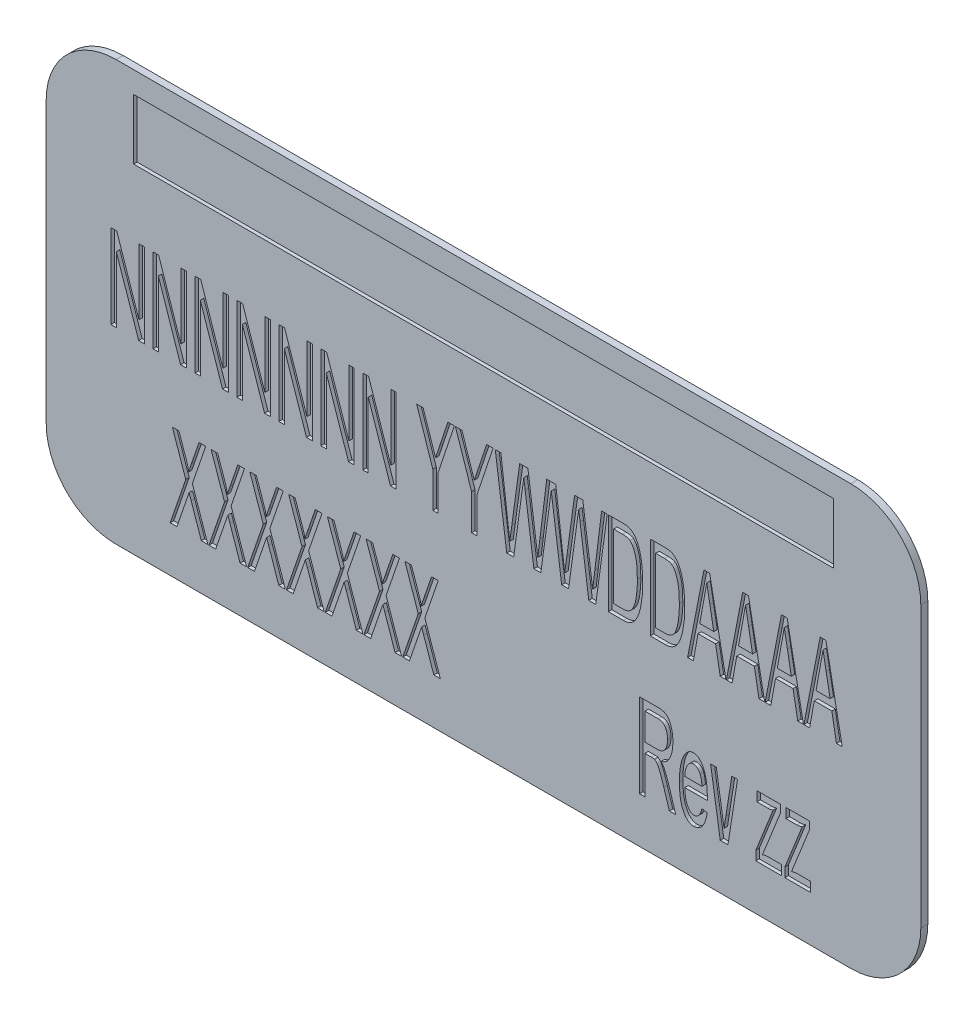
from build123d import *

# Parameters (mm, degrees)
BOSS_EXTRU_1_DEPTH      = 0.2
ENL_V_MAT_EXTRU_1_DEPTH = 0.1
ENL_V_MAT_EXTRU_2_DEPTH = 0.1
ESQUISSE10_W            = 20
ESQUISSE10_H            = 1.725075407
ENL_V_MAT_EXTRU_3_DEPTH = 0.1


with BuildPart() as part:
    # Esquisse1 → Boss.-Extru.1 (new body)
    with BuildSketch(Plane.XY):
        with BuildLine():
            Line((-21.848822837, 2.338176796), (-0.848822837, 2.338176796))
            ThreePointArc((-0.848822837, 2.338176796), (0.565390725, 1.752390358), (1.151177163, 0.338176796))
            Line((1.151177163, 0.338176796), (1.151177163, -7.661823204))
            ThreePointArc((1.151177163, -7.661823204), (0.565390725, -9.076036767), (-0.848822837, -9.661823204))
            Line((-0.848822837, -9.661823204), (-21.848822837, -9.661823204))
            ThreePointArc((-21.848822837, -9.661823204), (-23.263036399, -9.076036767), (-23.848822837, -7.661823204))
            Line((-23.848822837, -7.661823204), (-23.848822837, 0.338176796))
            ThreePointArc((-23.848822837, 0.338176796), (-23.263036399, 1.752390358), (-21.848822837, 2.338176796))
        make_face()
    extrude(amount=BOSS_EXTRU_1_DEPTH)

    # Esquisse2 → Enlèv. mat.-Extru.1 (cut)
    # profile 1 of 17: a face of its own
    with BuildSketch(Plane.XY.offset(0.2)):
        Polygon((-21.997375607, -4.2960697), (-21.997375607, -1.8960697), (-21.83295253, -1.8960697), (-21.197375607, -3.7773197), (-21.197375607, -1.8960697), (-21.043529453, -1.8960697), (-21.043529453, -4.2960697), (-21.20795253, -4.2960697), (-21.843529453, -2.415781238), (-21.843529453, -4.2960697), align=None)
    # profile 2 of 17: a face of its own
    with BuildSketch(Plane.XY.offset(0.2)):
        Polygon((-20.797375607, -4.2960697), (-20.797375607, -1.8960697), (-20.63295253, -1.8960697), (-19.997375607, -3.7773197), (-19.997375607, -1.8960697), (-19.843529453, -1.8960697), (-19.843529453, -4.2960697), (-20.00795253, -4.2960697), (-20.643529453, -2.415781238), (-20.643529453, -4.2960697), align=None)
    # profile 3 of 17: a face of its own
    with BuildSketch(Plane.XY.offset(0.2)):
        Polygon((-19.597375607, -4.2960697), (-19.597375607, -1.8960697), (-19.43295253, -1.8960697), (-18.797375607, -3.7773197), (-18.797375607, -1.8960697), (-18.643529453, -1.8960697), (-18.643529453, -4.2960697), (-18.80795253, -4.2960697), (-19.443529453, -2.415781238), (-19.443529453, -4.2960697), align=None)
    # profile 4 of 17: a face of its own
    with BuildSketch(Plane.XY.offset(0.2)):
        Polygon((-18.397375607, -4.2960697), (-18.397375607, -1.8960697), (-18.23295253, -1.8960697), (-17.597375607, -3.7773197), (-17.597375607, -1.8960697), (-17.443529453, -1.8960697), (-17.443529453, -4.2960697), (-17.60795253, -4.2960697), (-18.243529453, -2.415781238), (-18.243529453, -4.2960697), align=None)
    # profile 5 of 17: a face of its own
    with BuildSketch(Plane.XY.offset(0.2)):
        Polygon((-17.197375607, -4.2960697), (-17.197375607, -1.8960697), (-17.03295253, -1.8960697), (-16.397375607, -3.7773197), (-16.397375607, -1.8960697), (-16.243529453, -1.8960697), (-16.243529453, -4.2960697), (-16.40795253, -4.2960697), (-17.043529453, -2.415781238), (-17.043529453, -4.2960697), align=None)
    # profile 6 of 17: a face of its own
    with BuildSketch(Plane.XY.offset(0.2)):
        Polygon((-15.997375607, -4.2960697), (-15.997375607, -1.8960697), (-15.83295253, -1.8960697), (-15.197375607, -3.7773197), (-15.197375607, -1.8960697), (-15.043529453, -1.8960697), (-15.043529453, -4.2960697), (-15.20795253, -4.2960697), (-15.843529453, -2.415781238), (-15.843529453, -4.2960697), align=None)
    # profile 7 of 17: a face of its own
    with BuildSketch(Plane.XY.offset(0.2)):
        Polygon((-14.797375607, -4.2960697), (-14.797375607, -1.8960697), (-14.63295253, -1.8960697), (-13.997375607, -3.7773197), (-13.997375607, -1.8960697), (-13.843529453, -1.8960697), (-13.843529453, -4.2960697), (-14.00795253, -4.2960697), (-14.643529453, -2.415781238), (-14.643529453, -4.2960697), align=None)
    # profile 8 of 17: a face of its own
    with BuildSketch(Plane.XY.offset(0.2)):
        with BuildLine():
            Line((-12.797375607, -4.2960697), (-12.797375607, -3.279242777))
            Line((-12.797375607, -3.279242777), (-13.258914068, -1.8960697))
            Line((-13.258914068, -1.8960697), (-13.073817915, -1.8960697))
            Line((-13.073817915, -1.8960697), (-12.827664068, -2.634531238))
            add(Edge.make_bspline(
                [(-12.827664068, -2.634531238), (-12.817067101, -2.666255268), (-12.796997087, -2.726338659), (-12.768867352, -2.811567966), (-12.743009071, -2.886493789), (-12.727613049, -2.933392326), (-12.72045253, -2.955204315)],
                knots=[0, 0, 0, 0, 1.187045161, 2.248191592, 3.185253382, 4, 4, 4, 4], degree=3))
            add(Edge.make_bspline(
                [(-12.72045253, -2.955204315), (-12.717103326, -2.945102744), (-12.709974274, -2.923600726), (-12.698301361, -2.889564566), (-12.685939781, -2.85148447), (-12.672066077, -2.809793962), (-12.656454381, -2.764571995), (-12.640292101, -2.715417778), (-12.622425768, -2.662773253), (-12.610335281, -2.626365232), (-12.604106376, -2.607608161)],
                knots=[0, 0, 0, 0, 0.696802911, 1.483201767, 2.355870768, 3.318122407, 4.360029798, 5.488186892, 6.705937452, 8, 8, 8, 8], degree=3))
            Line((-12.604106376, -2.607608161), (-12.367087145, -1.8960697))
            Line((-12.367087145, -1.8960697), (-12.181990991, -1.8960697))
            Line((-12.181990991, -1.8960697), (-12.643529453, -3.279242777))
            Line((-12.643529453, -3.279242777), (-12.643529453, -4.2960697))
            Line((-12.643529453, -4.2960697), (-12.797375607, -4.2960697))
        make_face()
    # profile 9 of 17: a face of its own
    with BuildSketch(Plane.XY.offset(0.2)):
        with BuildLine():
            Line((-11.689683299, -4.2960697), (-11.689683299, -3.279242777))
            Line((-11.689683299, -3.279242777), (-12.151221761, -1.8960697))
            Line((-12.151221761, -1.8960697), (-11.966125607, -1.8960697))
            Line((-11.966125607, -1.8960697), (-11.719971761, -2.634531238))
            add(Edge.make_bspline(
                [(-11.719971761, -2.634531238), (-11.709374793, -2.666255268), (-11.68930478, -2.726338659), (-11.661175045, -2.811567966), (-11.635316764, -2.886493789), (-11.619920741, -2.933392326), (-11.612760222, -2.955204315)],
                knots=[0, 0, 0, 0, 1.187045161, 2.248191592, 3.185253382, 4, 4, 4, 4], degree=3))
            add(Edge.make_bspline(
                [(-11.612760222, -2.955204315), (-11.609411019, -2.945102744), (-11.602281966, -2.923600726), (-11.590609053, -2.889564566), (-11.578247473, -2.85148447), (-11.564373769, -2.809793962), (-11.548762073, -2.764571995), (-11.532599794, -2.715417778), (-11.51473346, -2.662773253), (-11.502642974, -2.626365232), (-11.496414068, -2.607608161)],
                knots=[0, 0, 0, 0, 0.696802911, 1.483201767, 2.355870768, 3.318122407, 4.360029798, 5.488186892, 6.705937452, 8, 8, 8, 8], degree=3))
            Line((-11.496414068, -2.607608161), (-11.259394838, -1.8960697))
            Line((-11.259394838, -1.8960697), (-11.074298684, -1.8960697))
            Line((-11.074298684, -1.8960697), (-11.535837145, -3.279242777))
            Line((-11.535837145, -3.279242777), (-11.535837145, -4.2960697))
            Line((-11.535837145, -4.2960697), (-11.689683299, -4.2960697))
        make_face()
    # profile 10 of 17: a face of its own
    with BuildSketch(Plane.XY.offset(0.2)):
        with BuildLine():
            Line((-10.684394838, -4.2960697), (-11.012760222, -1.8960697))
            Line((-11.012760222, -1.8960697), (-10.853144838, -1.8960697))
            Line((-10.853144838, -1.8960697), (-10.657471761, -3.473954315))
            add(Edge.make_bspline(
                [(-10.657471761, -3.473954315), (-10.64734577, -3.55520063), (-10.62713556, -3.717358111), (-10.607281913, -3.879559634), (-10.597375607, -3.960492777)],
                knots=[0, 0, 0, 0, 1.002066804, 2, 2, 2, 2], degree=3))
            add(Edge.make_bspline(
                [(-10.597375607, -3.960492777), (-10.59334946, -3.931008296), (-10.585757099, -3.875407539), (-10.575331413, -3.796839168), (-10.565567178, -3.728131758), (-10.557443171, -3.66915054), (-10.550742272, -3.620108005), (-10.545306797, -3.58102531), (-10.541670379, -3.551647588), (-10.53922511, -3.535329395), (-10.538240991, -3.528762007)],
                knots=[0, 0, 0, 0, 1.638949351, 3.090670897, 4.365107455, 5.461054644, 6.369771406, 7.091258957, 7.634269859, 8, 8, 8, 8], degree=3))
            Line((-10.538240991, -3.528762007), (-10.314683299, -1.8960697))
            Line((-10.314683299, -1.8960697), (-10.080067915, -1.8960697))
            Line((-10.080067915, -1.8960697), (-9.913721761, -3.110492777))
            add(Edge.make_bspline(
                [(-9.913721761, -3.110492777), (-9.903395012, -3.184201056), (-9.883014943, -3.329665999), (-9.854065415, -3.545146419), (-9.824841618, -3.754666571), (-9.806444072, -3.892535049), (-9.797375607, -3.960492777)],
                knots=[0, 0, 0, 0, 1.041039999, 2.054515778, 3.041037602, 4, 4, 4, 4], degree=3))
            add(Edge.make_bspline(
                [(-9.797375607, -3.960492777), (-9.792900857, -3.923792532), (-9.783539984, -3.847018114), (-9.768606492, -3.72666907), (-9.752165978, -3.596091717), (-9.741096244, -3.50552847), (-9.735356376, -3.4585697)],
                knots=[0, 0, 0, 0, 0.87725687, 1.835161778, 2.8774901, 4, 4, 4, 4], degree=3))
            Line((-9.735356376, -3.4585697), (-9.541606376, -1.8960697))
            Line((-9.541606376, -1.8960697), (-9.381990991, -1.8960697))
            Line((-9.381990991, -1.8960697), (-9.710356376, -4.2960697))
            Line((-9.710356376, -4.2960697), (-9.908433299, -4.2960697))
            Line((-9.908433299, -4.2960697), (-10.15795253, -2.474915854))
            add(Edge.make_bspline(
                [(-10.15795253, -2.474915854), (-10.160342745, -2.456805094), (-10.16489179, -2.422336787), (-10.171579216, -2.37329137), (-10.177935955, -2.329579239), (-10.183303599, -2.29096665), (-10.187492477, -2.257434043), (-10.191267169, -2.229057283), (-10.194833616, -2.205870674), (-10.196597195, -2.192066473), (-10.197375607, -2.185973546)],
                knots=[0, 0, 0, 0, 1.503406976, 2.861276566, 4.073641829, 5.138672782, 6.06948784, 6.854747432, 7.494505974, 8, 8, 8, 8], degree=3))
            add(Edge.make_bspline(
                [(-10.197375607, -2.185973546), (-10.201544917, -2.216101371), (-10.209439293, -2.273146869), (-10.220595945, -2.354063071), (-10.230051455, -2.42574122), (-10.236293275, -2.47043203), (-10.23920253, -2.491262007)],
                knots=[0, 0, 0, 0, 1.184456801, 2.242708451, 3.180942521, 4, 4, 4, 4], degree=3))
            Line((-10.23920253, -2.491262007), (-10.486798684, -4.2960697))
            Line((-10.486798684, -4.2960697), (-10.684394838, -4.2960697))
        make_face()
    # profile 11 of 17: a face of its own
    with BuildSketch(Plane.XY.offset(0.2)):
        with BuildLine():
            Line((-9.115164068, -4.2960697), (-9.443529453, -1.8960697))
            Line((-9.443529453, -1.8960697), (-9.283914068, -1.8960697))
            Line((-9.283914068, -1.8960697), (-9.088240991, -3.473954315))
            add(Edge.make_bspline(
                [(-9.088240991, -3.473954315), (-9.078115001, -3.55520063), (-9.057904791, -3.717358111), (-9.038051144, -3.879559634), (-9.028144838, -3.960492777)],
                knots=[0, 0, 0, 0, 1.002066804, 2, 2, 2, 2], degree=3))
            add(Edge.make_bspline(
                [(-9.028144838, -3.960492777), (-9.024118691, -3.931008296), (-9.016526329, -3.875407539), (-9.006100643, -3.796839168), (-8.996336409, -3.728131758), (-8.988212402, -3.66915054), (-8.981511503, -3.620108005), (-8.976076028, -3.58102531), (-8.972439609, -3.551647588), (-8.96999434, -3.535329395), (-8.969010222, -3.528762007)],
                knots=[0, 0, 0, 0, 1.638949351, 3.090670897, 4.365107455, 5.461054644, 6.369771406, 7.091258957, 7.634269859, 8, 8, 8, 8], degree=3))
            Line((-8.969010222, -3.528762007), (-8.74545253, -1.8960697))
            Line((-8.74545253, -1.8960697), (-8.510837145, -1.8960697))
            Line((-8.510837145, -1.8960697), (-8.344490991, -3.110492777))
            add(Edge.make_bspline(
                [(-8.344490991, -3.110492777), (-8.334164243, -3.184201056), (-8.313784174, -3.329665999), (-8.284834645, -3.545146419), (-8.255610849, -3.754666571), (-8.237213302, -3.892535049), (-8.228144838, -3.960492777)],
                knots=[0, 0, 0, 0, 1.041039999, 2.054515778, 3.041037602, 4, 4, 4, 4], degree=3))
            add(Edge.make_bspline(
                [(-8.228144838, -3.960492777), (-8.223670088, -3.923792532), (-8.214309215, -3.847018114), (-8.199375722, -3.72666907), (-8.182935208, -3.596091717), (-8.171865475, -3.50552847), (-8.166125607, -3.4585697)],
                knots=[0, 0, 0, 0, 0.87725687, 1.835161778, 2.8774901, 4, 4, 4, 4], degree=3))
            Line((-8.166125607, -3.4585697), (-7.972375607, -1.8960697))
            Line((-7.972375607, -1.8960697), (-7.812760222, -1.8960697))
            Line((-7.812760222, -1.8960697), (-8.141125607, -4.2960697))
            Line((-8.141125607, -4.2960697), (-8.33920253, -4.2960697))
            Line((-8.33920253, -4.2960697), (-8.588721761, -2.474915854))
            add(Edge.make_bspline(
                [(-8.588721761, -2.474915854), (-8.591111976, -2.456805094), (-8.595661021, -2.422336787), (-8.602348446, -2.37329137), (-8.608705186, -2.329579239), (-8.61407283, -2.29096665), (-8.618261708, -2.257434043), (-8.6220364, -2.229057283), (-8.625602847, -2.205870674), (-8.627366425, -2.192066473), (-8.628144838, -2.185973546)],
                knots=[0, 0, 0, 0, 1.503406976, 2.861276566, 4.073641829, 5.138672782, 6.06948784, 6.854747432, 7.494505974, 8, 8, 8, 8], degree=3))
            add(Edge.make_bspline(
                [(-8.628144838, -2.185973546), (-8.632314148, -2.216101371), (-8.640208523, -2.273146869), (-8.651365176, -2.354063071), (-8.660820686, -2.42574122), (-8.667062506, -2.47043203), (-8.669971761, -2.491262007)],
                knots=[0, 0, 0, 0, 1.184456801, 2.242708451, 3.180942521, 4, 4, 4, 4], degree=3))
            Line((-8.669971761, -2.491262007), (-8.917567915, -4.2960697))
            Line((-8.917567915, -4.2960697), (-9.115164068, -4.2960697))
        make_face()
    # profile 12 of 17: a face of its own
    with BuildSketch(Plane.XY.offset(0.2)):
        with BuildLine():
            Line((-7.781990991, -4.2960697), (-7.781990991, -1.8960697))
            Line((-7.781990991, -1.8960697), (-7.371894838, -1.8960697))
            add(Edge.make_bspline(
                [(-7.371894838, -1.8960697), (-7.350069147, -1.896272053), (-7.30902258, -1.89665261), (-7.25185344, -1.90372178), (-7.202192317, -1.913210612), (-7.173360356, -1.925116625), (-7.159875607, -1.930685084)],
                knots=[0, 0, 0, 0, 1.209218742, 2.274121739, 3.192804279, 4, 4, 4, 4], degree=3))
            add(Edge.make_bspline(
                [(-7.159875607, -1.930685084), (-7.1429887, -1.939553597), (-7.108524287, -1.957653304), (-7.062559089, -1.99699691), (-7.020469971, -2.04542114), (-6.997032248, -2.082886978), (-6.984875607, -2.1023197)],
                knots=[0, 0, 0, 0, 0.917248745, 1.872008839, 2.896256901, 4, 4, 4, 4], degree=3))
            add(Edge.make_bspline(
                [(-6.984875607, -2.1023197), (-6.969512609, -2.130712462), (-6.937663802, -2.189573081), (-6.900374035, -2.287459236), (-6.86834118, -2.395819561), (-6.842091141, -2.515043085), (-6.822557043, -2.644234502), (-6.80745918, -2.782469394), (-6.798962305, -2.92977629), (-6.797914749, -3.030995025), (-6.797375607, -3.08308893)],
                knots=[0, 0, 0, 0, 0.767236926, 1.590547629, 2.485512821, 3.453908061, 4.491812888, 5.592276963, 6.760825303, 8, 8, 8, 8], degree=3))
            add(Edge.make_bspline(
                [(-6.797375607, -3.08308893), (-6.797734491, -3.127325518), (-6.798431779, -3.213274234), (-6.804101816, -3.338375127), (-6.814120268, -3.455772153), (-6.828056545, -3.565114852), (-6.844761439, -3.665988029), (-6.863863141, -3.758098618), (-6.885292506, -3.841073982), (-6.908774243, -3.915291549), (-6.934587797, -3.980856525), (-6.960532503, -4.039332869), (-6.988754761, -4.090049996), (-7.017325855, -4.134479041), (-7.048962859, -4.172386037), (-7.082910352, -4.20529648), (-7.120528117, -4.23276087), (-7.160522679, -4.256351706), (-7.204212878, -4.273917856), (-7.250740589, -4.287094084), (-7.300480146, -4.294858602), (-7.334688136, -4.295659892), (-7.352183299, -4.2960697)],
                knots=[0, 0, 0, 0, 1.800094546, 3.497462691, 5.094565961, 6.593423588, 7.981807382, 9.254415828, 10.420159978, 11.4678544, 12.419732639, 13.286514356, 14.068783023, 14.77961528, 15.432569631, 16.073692928, 16.698454999, 17.323727399, 17.958316615, 18.608660443, 19.28842027, 20, 20, 20, 20], degree=3))
            Line((-7.352183299, -4.2960697), (-7.781990991, -4.2960697))
        make_face()
        with BuildLine():
            Line((-7.628144838, -4.019146623), (-7.369010222, -4.019146623))
            add(Edge.make_bspline(
                [(-7.369010222, -4.019146623), (-7.350070326, -4.018612707), (-7.31423792, -4.017602591), (-7.263549605, -4.009607202), (-7.219262298, -3.995742153), (-7.180760123, -3.976354059), (-7.148017238, -3.950779936), (-7.118601781, -3.921541031), (-7.092801506, -3.887480237), (-7.078956833, -3.862286232), (-7.071894838, -3.849435084)],
                knots=[0, 0, 0, 0, 1.249650705, 2.364215218, 3.374377069, 4.301504878, 5.192076899, 6.104488424, 7.03312322, 8, 8, 8, 8], degree=3))
            add(Edge.make_bspline(
                [(-7.071894838, -3.849435084), (-7.062507897, -3.82892486), (-7.042651381, -3.785538884), (-7.01994002, -3.713252216), (-6.999179296, -3.631927373), (-6.982119415, -3.540529515), (-6.968308134, -3.439296282), (-6.95846237, -3.327796821), (-6.952077435, -3.206240683), (-6.951514351, -3.121719502), (-6.951221761, -3.077800469)],
                knots=[0, 0, 0, 0, 0.687444329, 1.454174466, 2.306617836, 3.247115966, 4.288242282, 5.422094717, 6.6604647, 8, 8, 8, 8], degree=3))
            add(Edge.make_bspline(
                [(-6.951221761, -3.077800469), (-6.951396663, -3.047189318), (-6.951736478, -2.987715521), (-6.954632478, -2.901146476), (-6.959411483, -2.820031756), (-6.965782424, -2.744446197), (-6.975329987, -2.674467518), (-6.985306014, -2.609670497), (-6.998482148, -2.550557708), (-7.012925305, -2.496654269), (-7.028826796, -2.447614193), (-7.045580352, -2.402816981), (-7.063238842, -2.362278093), (-7.082187372, -2.326169336), (-7.101128545, -2.293725891), (-7.121394006, -2.26571803), (-7.142396901, -2.241686011), (-7.158097617, -2.228736664), (-7.165644838, -2.222512007)],
                knots=[0, 0, 0, 0, 1.624486671, 3.156182828, 4.595991041, 5.936527029, 7.180250294, 8.343530302, 9.414514798, 10.39240733, 11.304157138, 12.14925215, 12.929879803, 13.64881622, 14.312455318, 14.921477323, 15.481561996, 16, 16, 16, 16], degree=3))
            add(Edge.make_bspline(
                [(-7.165644838, -2.222512007), (-7.177703233, -2.214711662), (-7.203700334, -2.197894634), (-7.252244455, -2.183930835), (-7.309445517, -2.173946744), (-7.350999189, -2.173326305), (-7.373337145, -2.172992777)],
                knots=[0, 0, 0, 0, 0.790842195, 1.705003453, 2.766281536, 4, 4, 4, 4], degree=3))
            Line((-7.373337145, -2.172992777), (-7.628144838, -2.172992777))
            Line((-7.628144838, -2.172992777), (-7.628144838, -4.019146623))
        make_face(mode=Mode.SUBTRACT)
    # profile 13 of 17: a face of its own
    with BuildSketch(Plane.XY.offset(0.2)):
        with BuildLine():
            Line((-6.581990991, -4.2960697), (-6.581990991, -1.8960697))
            Line((-6.581990991, -1.8960697), (-6.171894838, -1.8960697))
            add(Edge.make_bspline(
                [(-6.171894838, -1.8960697), (-6.150069147, -1.896272053), (-6.10902258, -1.89665261), (-6.05185344, -1.90372178), (-6.002192317, -1.913210612), (-5.973360356, -1.925116625), (-5.959875607, -1.930685084)],
                knots=[0, 0, 0, 0, 1.209218742, 2.274121739, 3.192804279, 4, 4, 4, 4], degree=3))
            add(Edge.make_bspline(
                [(-5.959875607, -1.930685084), (-5.9429887, -1.939553597), (-5.908524287, -1.957653304), (-5.862559089, -1.99699691), (-5.820469971, -2.04542114), (-5.797032248, -2.082886978), (-5.784875607, -2.1023197)],
                knots=[0, 0, 0, 0, 0.917248745, 1.872008839, 2.896256901, 4, 4, 4, 4], degree=3))
            add(Edge.make_bspline(
                [(-5.784875607, -2.1023197), (-5.769512609, -2.130712462), (-5.737663802, -2.189573081), (-5.700374035, -2.287459236), (-5.66834118, -2.395819561), (-5.642091141, -2.515043085), (-5.622557043, -2.644234502), (-5.60745918, -2.782469394), (-5.598962305, -2.92977629), (-5.597914749, -3.030995025), (-5.597375607, -3.08308893)],
                knots=[0, 0, 0, 0, 0.767236926, 1.590547629, 2.485512821, 3.453908061, 4.491812888, 5.592276963, 6.760825303, 8, 8, 8, 8], degree=3))
            add(Edge.make_bspline(
                [(-5.597375607, -3.08308893), (-5.597734491, -3.127325518), (-5.598431779, -3.213274234), (-5.604101816, -3.338375127), (-5.614120268, -3.455772153), (-5.628056545, -3.565114852), (-5.644761439, -3.665988029), (-5.663863141, -3.758098618), (-5.685292506, -3.841073982), (-5.708774243, -3.915291549), (-5.734587797, -3.980856525), (-5.760532503, -4.039332869), (-5.788754761, -4.090049996), (-5.817325855, -4.134479041), (-5.848962859, -4.172386037), (-5.882910352, -4.20529648), (-5.920528117, -4.23276087), (-5.960522679, -4.256351706), (-6.004212878, -4.273917856), (-6.050740589, -4.287094084), (-6.100480146, -4.294858602), (-6.134688136, -4.295659892), (-6.152183299, -4.2960697)],
                knots=[0, 0, 0, 0, 1.800094546, 3.497462691, 5.094565961, 6.593423588, 7.981807382, 9.254415828, 10.420159978, 11.4678544, 12.419732639, 13.286514356, 14.068783023, 14.77961528, 15.432569631, 16.073692928, 16.698454999, 17.323727399, 17.958316615, 18.608660443, 19.28842027, 20, 20, 20, 20], degree=3))
            Line((-6.152183299, -4.2960697), (-6.581990991, -4.2960697))
        make_face()
        with BuildLine():
            Line((-6.428144838, -4.019146623), (-6.169010222, -4.019146623))
            add(Edge.make_bspline(
                [(-6.169010222, -4.019146623), (-6.150070326, -4.018612707), (-6.11423792, -4.017602591), (-6.063549605, -4.009607202), (-6.019262298, -3.995742153), (-5.980760123, -3.976354059), (-5.948017238, -3.950779936), (-5.918601781, -3.921541031), (-5.892801506, -3.887480237), (-5.878956833, -3.862286232), (-5.871894838, -3.849435084)],
                knots=[0, 0, 0, 0, 1.249650705, 2.364215218, 3.374377069, 4.301504878, 5.192076899, 6.104488424, 7.03312322, 8, 8, 8, 8], degree=3))
            add(Edge.make_bspline(
                [(-5.871894838, -3.849435084), (-5.862507897, -3.82892486), (-5.842651381, -3.785538884), (-5.81994002, -3.713252216), (-5.799179296, -3.631927373), (-5.782119415, -3.540529515), (-5.768308134, -3.439296282), (-5.75846237, -3.327796821), (-5.752077435, -3.206240683), (-5.751514351, -3.121719502), (-5.751221761, -3.077800469)],
                knots=[0, 0, 0, 0, 0.687444329, 1.454174466, 2.306617836, 3.247115966, 4.288242282, 5.422094717, 6.6604647, 8, 8, 8, 8], degree=3))
            add(Edge.make_bspline(
                [(-5.751221761, -3.077800469), (-5.751396663, -3.047189318), (-5.751736478, -2.987715521), (-5.754632478, -2.901146476), (-5.759411483, -2.820031756), (-5.765782424, -2.744446197), (-5.775329987, -2.674467518), (-5.785306014, -2.609670497), (-5.798482148, -2.550557708), (-5.812925305, -2.496654269), (-5.828826796, -2.447614193), (-5.845580352, -2.402816981), (-5.863238842, -2.362278093), (-5.882187372, -2.326169336), (-5.901128545, -2.293725891), (-5.921394006, -2.26571803), (-5.942396901, -2.241686011), (-5.958097617, -2.228736664), (-5.965644838, -2.222512007)],
                knots=[0, 0, 0, 0, 1.624486671, 3.156182828, 4.595991041, 5.936527029, 7.180250294, 8.343530302, 9.414514798, 10.39240733, 11.304157138, 12.14925215, 12.929879803, 13.64881622, 14.312455318, 14.921477323, 15.481561996, 16, 16, 16, 16], degree=3))
            add(Edge.make_bspline(
                [(-5.965644838, -2.222512007), (-5.977703233, -2.214711662), (-6.003700334, -2.197894634), (-6.052244455, -2.183930835), (-6.109445517, -2.173946744), (-6.150999189, -2.173326305), (-6.173337145, -2.172992777)],
                knots=[0, 0, 0, 0, 0.790842195, 1.705003453, 2.766281536, 4, 4, 4, 4], degree=3))
            Line((-6.173337145, -2.172992777), (-6.428144838, -2.172992777))
            Line((-6.428144838, -2.172992777), (-6.428144838, -4.019146623))
        make_face(mode=Mode.SUBTRACT)
    # profile 14 of 17: a face of its own
    with BuildSketch(Plane.XY.offset(0.2)):
        Polygon((-5.514683299, -4.2960697), (-5.048337145, -1.8960697), (-4.884875607, -1.8960697), (-4.418529453, -4.2960697), (-4.581990991, -4.2960697), (-4.715644838, -3.557608161), (-5.217087145, -3.557608161), (-5.351221761, -4.2960697), align=None)
        with BuildLine():
            Line((-5.167087145, -3.280685084), (-4.766125607, -3.280685084))
            Line((-4.766125607, -3.280685084), (-4.878625607, -2.659531238))
            add(Edge.make_bspline(
                [(-4.878625607, -2.659531238), (-4.883146751, -2.63501815), (-4.891949862, -2.587288759), (-4.904237011, -2.517509795), (-4.916598193, -2.451414092), (-4.927291481, -2.388820304), (-4.938108839, -2.329728617), (-4.948017641, -2.274245704), (-4.957796779, -2.222381837), (-4.963747036, -2.189023033), (-4.966606376, -2.172992777)],
                knots=[0, 0, 0, 0, 1.209945762, 2.355883214, 3.439198162, 4.473827899, 5.438166865, 6.355192696, 7.209603446, 8, 8, 8, 8], degree=3))
            add(Edge.make_bspline(
                [(-4.966606376, -2.172992777), (-4.979872677, -2.246877314), (-5.006582583, -2.395633853), (-5.03371789, -2.544313382), (-5.047375607, -2.619146623)],
                knots=[0, 0, 0, 0, 0.993361883, 2, 2, 2, 2], degree=3))
            Line((-5.047375607, -2.619146623), (-5.167087145, -3.280685084))
        make_face(mode=Mode.SUBTRACT)
    # profile 15 of 17: a face of its own
    with BuildSketch(Plane.XY.offset(0.2)):
        Polygon((-4.406990991, -4.2960697), (-3.940644838, -1.8960697), (-3.777183299, -1.8960697), (-3.310837145, -4.2960697), (-3.474298684, -4.2960697), (-3.60795253, -3.557608161), (-4.109394838, -3.557608161), (-4.243529453, -4.2960697), align=None)
        with BuildLine():
            Line((-4.059394838, -3.280685084), (-3.658433299, -3.280685084))
            Line((-3.658433299, -3.280685084), (-3.770933299, -2.659531238))
            add(Edge.make_bspline(
                [(-3.770933299, -2.659531238), (-3.775454443, -2.63501815), (-3.784257555, -2.587288759), (-3.796544703, -2.517509795), (-3.808905885, -2.451414092), (-3.819599173, -2.388820304), (-3.830416532, -2.329728617), (-3.840325334, -2.274245704), (-3.850104472, -2.222381837), (-3.856054729, -2.189023033), (-3.858914068, -2.172992777)],
                knots=[0, 0, 0, 0, 1.209945762, 2.355883214, 3.439198162, 4.473827899, 5.438166865, 6.355192696, 7.209603446, 8, 8, 8, 8], degree=3))
            add(Edge.make_bspline(
                [(-3.858914068, -2.172992777), (-3.872180369, -2.246877314), (-3.898890275, -2.395633853), (-3.926025582, -2.544313382), (-3.939683299, -2.619146623)],
                knots=[0, 0, 0, 0, 0.993361883, 2, 2, 2, 2], degree=3))
            Line((-3.939683299, -2.619146623), (-4.059394838, -3.280685084))
        make_face(mode=Mode.SUBTRACT)
    # profile 16 of 17: a face of its own
    with BuildSketch(Plane.XY.offset(0.2)):
        Polygon((-3.299298684, -4.2960697), (-2.83295253, -1.8960697), (-2.669490991, -1.8960697), (-2.203144838, -4.2960697), (-2.366606376, -4.2960697), (-2.500260222, -3.557608161), (-3.00170253, -3.557608161), (-3.135837145, -4.2960697), align=None)
        with BuildLine():
            Line((-2.95170253, -3.280685084), (-2.550740991, -3.280685084))
            Line((-2.550740991, -3.280685084), (-2.663240991, -2.659531238))
            add(Edge.make_bspline(
                [(-2.663240991, -2.659531238), (-2.667762136, -2.63501815), (-2.676565247, -2.587288759), (-2.688852395, -2.517509795), (-2.701213578, -2.451414092), (-2.711906865, -2.388820304), (-2.722724224, -2.329728617), (-2.732633026, -2.274245704), (-2.742412164, -2.222381837), (-2.748362421, -2.189023033), (-2.751221761, -2.172992777)],
                knots=[0, 0, 0, 0, 1.209945762, 2.355883214, 3.439198162, 4.473827899, 5.438166865, 6.355192696, 7.209603446, 8, 8, 8, 8], degree=3))
            add(Edge.make_bspline(
                [(-2.751221761, -2.172992777), (-2.764488062, -2.246877314), (-2.791197967, -2.395633853), (-2.818333274, -2.544313382), (-2.831990991, -2.619146623)],
                knots=[0, 0, 0, 0, 0.993361883, 2, 2, 2, 2], degree=3))
            Line((-2.831990991, -2.619146623), (-2.95170253, -3.280685084))
        make_face(mode=Mode.SUBTRACT)
    # profile 17 of 17: a face of its own
    with BuildSketch(Plane.XY.offset(0.2)):
        Polygon((-2.191606376, -4.2960697), (-1.725260222, -1.8960697), (-1.561798684, -1.8960697), (-1.09545253, -4.2960697), (-1.258914068, -4.2960697), (-1.392567915, -3.557608161), (-1.894010222, -3.557608161), (-2.028144838, -4.2960697), align=None)
        with BuildLine():
            Line((-1.844010222, -3.280685084), (-1.443048684, -3.280685084))
            Line((-1.443048684, -3.280685084), (-1.555548684, -2.659531238))
            add(Edge.make_bspline(
                [(-1.555548684, -2.659531238), (-1.560069828, -2.63501815), (-1.568872939, -2.587288759), (-1.581160088, -2.517509795), (-1.59352127, -2.451414092), (-1.604214558, -2.388820304), (-1.615031916, -2.329728617), (-1.624940718, -2.274245704), (-1.634719856, -2.222381837), (-1.640670113, -2.189023033), (-1.643529453, -2.172992777)],
                knots=[0, 0, 0, 0, 1.209945762, 2.355883214, 3.439198162, 4.473827899, 5.438166865, 6.355192696, 7.209603446, 8, 8, 8, 8], degree=3))
            add(Edge.make_bspline(
                [(-1.643529453, -2.172992777), (-1.656795754, -2.246877314), (-1.68350566, -2.395633853), (-1.710640967, -2.544313382), (-1.724298684, -2.619146623)],
                knots=[0, 0, 0, 0, 0.993361883, 2, 2, 2, 2], degree=3))
            Line((-1.724298684, -2.619146623), (-1.844010222, -3.280685084))
        make_face(mode=Mode.SUBTRACT)
    extrude(amount=-ENL_V_MAT_EXTRU_1_DEPTH, mode=Mode.SUBTRACT)

    # Esquisse8 → Enlèv. mat.-Extru.2 (cut)
    # profile 1 of 12: a face of its own
    with BuildSketch(Plane.XY.offset(0.2)):
        with BuildLine():
            Line((-20.304250109, -8.356300295), (-19.860500109, -7.063511833))
            Line((-19.860500109, -7.063511833), (-20.242711648, -5.956300295))
            Line((-20.242711648, -5.956300295), (-20.055211648, -5.956300295))
            Line((-20.055211648, -5.956300295), (-19.837423186, -6.587069525))
            add(Edge.make_bspline(
                [(-19.837423186, -6.587069525), (-19.832433738, -6.60228607), (-19.82289605, -6.63137359), (-19.809613489, -6.673030679), (-19.799598971, -6.711108998), (-19.791746444, -6.745241203), (-19.786462029, -6.775409745), (-19.78316076, -6.801720566), (-19.783068459, -6.824319305), (-19.784739943, -6.838040751), (-19.785500109, -6.844281064)],
                knots=[0, 0, 0, 0, 1.453428248, 2.778332613, 3.967248284, 5.025801759, 5.955965637, 6.746200148, 7.429790105, 8, 8, 8, 8], degree=3))
            add(Edge.make_bspline(
                [(-19.785500109, -6.844281064), (-19.778879034, -6.825388158), (-19.765151268, -6.786216672), (-19.744858883, -6.725078534), (-19.721863247, -6.660046763), (-19.706455789, -6.615127472), (-19.698480879, -6.591877218)],
                knots=[0, 0, 0, 0, 0.899792049, 1.865578155, 2.895221838, 4, 4, 4, 4], degree=3))
            Line((-19.698480879, -6.591877218), (-19.480692417, -5.956300295))
            Line((-19.480692417, -5.956300295), (-19.288865494, -5.956300295))
            Line((-19.288865494, -5.956300295), (-19.671077033, -7.070242602))
            Line((-19.671077033, -7.070242602), (-19.227327033, -8.356300295))
            Line((-19.227327033, -8.356300295), (-19.414827033, -8.356300295))
            Line((-19.414827033, -8.356300295), (-19.706173186, -7.509665679))
            add(Edge.make_bspline(
                [(-19.706173186, -7.509665679), (-19.715326934, -7.483390245), (-19.734851235, -7.42734659), (-19.75411441, -7.371212633), (-19.764346263, -7.341396449)],
                knots=[0, 0, 0, 0, 0.937677431, 2, 2, 2, 2], degree=3))
            add(Edge.make_bspline(
                [(-19.764346263, -7.341396449), (-19.771285038, -7.361572474), (-19.783942824, -7.398377791), (-19.800533609, -7.448728435), (-19.81462384, -7.488310979), (-19.822536082, -7.511422721), (-19.825884725, -7.521204141)],
                knots=[0, 0, 0, 0, 1.347179553, 2.45753912, 3.347195111, 4, 4, 4, 4], degree=3))
            Line((-19.825884725, -7.521204141), (-20.112423186, -8.356300295))
            Line((-20.112423186, -8.356300295), (-20.304250109, -8.356300295))
        make_face()
    # profile 2 of 12: a face of its own
    with BuildSketch(Plane.XY.offset(0.2)):
        with BuildLine():
            Line((-19.196557802, -8.356300295), (-18.752807802, -7.063511833))
            Line((-18.752807802, -7.063511833), (-19.13501934, -5.956300295))
            Line((-19.13501934, -5.956300295), (-18.94751934, -5.956300295))
            Line((-18.94751934, -5.956300295), (-18.729730879, -6.587069525))
            add(Edge.make_bspline(
                [(-18.729730879, -6.587069525), (-18.724741431, -6.60228607), (-18.715203742, -6.63137359), (-18.701921182, -6.673030679), (-18.691906664, -6.711108998), (-18.684054137, -6.745241203), (-18.678769721, -6.775409745), (-18.675468452, -6.801720566), (-18.675376151, -6.824319305), (-18.677047635, -6.838040751), (-18.677807802, -6.844281064)],
                knots=[0, 0, 0, 0, 1.453428248, 2.778332613, 3.967248284, 5.025801759, 5.955965637, 6.746200148, 7.429790105, 8, 8, 8, 8], degree=3))
            add(Edge.make_bspline(
                [(-18.677807802, -6.844281064), (-18.671186726, -6.825388158), (-18.65745896, -6.786216672), (-18.637166575, -6.725078534), (-18.614170939, -6.660046763), (-18.598763481, -6.615127472), (-18.590788571, -6.591877218)],
                knots=[0, 0, 0, 0, 0.899792049, 1.865578155, 2.895221838, 4, 4, 4, 4], degree=3))
            Line((-18.590788571, -6.591877218), (-18.373000109, -5.956300295))
            Line((-18.373000109, -5.956300295), (-18.181173186, -5.956300295))
            Line((-18.181173186, -5.956300295), (-18.563384725, -7.070242602))
            Line((-18.563384725, -7.070242602), (-18.119634725, -8.356300295))
            Line((-18.119634725, -8.356300295), (-18.307134725, -8.356300295))
            Line((-18.307134725, -8.356300295), (-18.598480879, -7.509665679))
            add(Edge.make_bspline(
                [(-18.598480879, -7.509665679), (-18.607634627, -7.483390245), (-18.627158927, -7.42734659), (-18.646422103, -7.371212633), (-18.656653956, -7.341396449)],
                knots=[0, 0, 0, 0, 0.937677431, 2, 2, 2, 2], degree=3))
            add(Edge.make_bspline(
                [(-18.656653956, -7.341396449), (-18.66359273, -7.361572474), (-18.676250516, -7.398377791), (-18.692841302, -7.448728435), (-18.706931533, -7.488310979), (-18.714843775, -7.511422721), (-18.718192417, -7.521204141)],
                knots=[0, 0, 0, 0, 1.347179553, 2.45753912, 3.347195111, 4, 4, 4, 4], degree=3))
            Line((-18.718192417, -7.521204141), (-19.004730879, -8.356300295))
            Line((-19.004730879, -8.356300295), (-19.196557802, -8.356300295))
        make_face()
    # profile 3 of 12: a face of its own
    with BuildSketch(Plane.XY.offset(0.2)):
        with BuildLine():
            Line((-18.088865494, -8.356300295), (-17.645115494, -7.063511833))
            Line((-17.645115494, -7.063511833), (-18.027327033, -5.956300295))
            Line((-18.027327033, -5.956300295), (-17.839827033, -5.956300295))
            Line((-17.839827033, -5.956300295), (-17.622038571, -6.587069525))
            add(Edge.make_bspline(
                [(-17.622038571, -6.587069525), (-17.617049123, -6.60228607), (-17.607511434, -6.63137359), (-17.594228874, -6.673030679), (-17.584214356, -6.711108998), (-17.576361829, -6.745241203), (-17.571077413, -6.775409745), (-17.567776144, -6.801720566), (-17.567683844, -6.824319305), (-17.569355327, -6.838040751), (-17.570115494, -6.844281064)],
                knots=[0, 0, 0, 0, 1.453428248, 2.778332613, 3.967248284, 5.025801759, 5.955965637, 6.746200148, 7.429790105, 8, 8, 8, 8], degree=3))
            add(Edge.make_bspline(
                [(-17.570115494, -6.844281064), (-17.563494418, -6.825388158), (-17.549766653, -6.786216672), (-17.529474268, -6.725078534), (-17.506478632, -6.660046763), (-17.491071174, -6.615127472), (-17.483096263, -6.591877218)],
                knots=[0, 0, 0, 0, 0.899792049, 1.865578155, 2.895221838, 4, 4, 4, 4], degree=3))
            Line((-17.483096263, -6.591877218), (-17.265307802, -5.956300295))
            Line((-17.265307802, -5.956300295), (-17.073480879, -5.956300295))
            Line((-17.073480879, -5.956300295), (-17.455692417, -7.070242602))
            Line((-17.455692417, -7.070242602), (-17.011942417, -8.356300295))
            Line((-17.011942417, -8.356300295), (-17.199442417, -8.356300295))
            Line((-17.199442417, -8.356300295), (-17.490788571, -7.509665679))
            add(Edge.make_bspline(
                [(-17.490788571, -7.509665679), (-17.499942319, -7.483390245), (-17.51946662, -7.42734659), (-17.538729795, -7.371212633), (-17.548961648, -7.341396449)],
                knots=[0, 0, 0, 0, 0.937677431, 2, 2, 2, 2], degree=3))
            add(Edge.make_bspline(
                [(-17.548961648, -7.341396449), (-17.555900423, -7.361572474), (-17.568558208, -7.398377791), (-17.585148994, -7.448728435), (-17.599239225, -7.488310979), (-17.607151467, -7.511422721), (-17.610500109, -7.521204141)],
                knots=[0, 0, 0, 0, 1.347179553, 2.45753912, 3.347195111, 4, 4, 4, 4], degree=3))
            Line((-17.610500109, -7.521204141), (-17.897038571, -8.356300295))
            Line((-17.897038571, -8.356300295), (-18.088865494, -8.356300295))
        make_face()
    # profile 4 of 12: a face of its own
    with BuildSketch(Plane.XY.offset(0.2)):
        with BuildLine():
            Line((-16.981173186, -8.356300295), (-16.537423186, -7.063511833))
            Line((-16.537423186, -7.063511833), (-16.919634725, -5.956300295))
            Line((-16.919634725, -5.956300295), (-16.732134725, -5.956300295))
            Line((-16.732134725, -5.956300295), (-16.514346263, -6.587069525))
            add(Edge.make_bspline(
                [(-16.514346263, -6.587069525), (-16.509356815, -6.60228607), (-16.499819127, -6.63137359), (-16.486536566, -6.673030679), (-16.476522048, -6.711108998), (-16.468669521, -6.745241203), (-16.463385106, -6.775409745), (-16.460083837, -6.801720566), (-16.459991536, -6.824319305), (-16.46166302, -6.838040751), (-16.462423186, -6.844281064)],
                knots=[0, 0, 0, 0, 1.453428248, 2.778332613, 3.967248284, 5.025801759, 5.955965637, 6.746200148, 7.429790105, 8, 8, 8, 8], degree=3))
            add(Edge.make_bspline(
                [(-16.462423186, -6.844281064), (-16.455802111, -6.825388158), (-16.442074345, -6.786216672), (-16.42178196, -6.725078534), (-16.398786324, -6.660046763), (-16.383378866, -6.615127472), (-16.375403956, -6.591877218)],
                knots=[0, 0, 0, 0, 0.899792049, 1.865578155, 2.895221838, 4, 4, 4, 4], degree=3))
            Line((-16.375403956, -6.591877218), (-16.157615494, -5.956300295))
            Line((-16.157615494, -5.956300295), (-15.965788571, -5.956300295))
            Line((-15.965788571, -5.956300295), (-16.348000109, -7.070242602))
            Line((-16.348000109, -7.070242602), (-15.904250109, -8.356300295))
            Line((-15.904250109, -8.356300295), (-16.091750109, -8.356300295))
            Line((-16.091750109, -8.356300295), (-16.383096263, -7.509665679))
            add(Edge.make_bspline(
                [(-16.383096263, -7.509665679), (-16.392250011, -7.483390245), (-16.411774312, -7.42734659), (-16.431037487, -7.371212633), (-16.44126934, -7.341396449)],
                knots=[0, 0, 0, 0, 0.937677431, 2, 2, 2, 2], degree=3))
            add(Edge.make_bspline(
                [(-16.44126934, -7.341396449), (-16.448208115, -7.361572474), (-16.460865901, -7.398377791), (-16.477456686, -7.448728435), (-16.491546917, -7.488310979), (-16.499459159, -7.511422721), (-16.502807802, -7.521204141)],
                knots=[0, 0, 0, 0, 1.347179553, 2.45753912, 3.347195111, 4, 4, 4, 4], degree=3))
            Line((-16.502807802, -7.521204141), (-16.789346263, -8.356300295))
            Line((-16.789346263, -8.356300295), (-16.981173186, -8.356300295))
        make_face()
    # profile 5 of 12: a face of its own
    with BuildSketch(Plane.XY.offset(0.2)):
        with BuildLine():
            Line((-15.873480879, -8.356300295), (-15.429730879, -7.063511833))
            Line((-15.429730879, -7.063511833), (-15.811942417, -5.956300295))
            Line((-15.811942417, -5.956300295), (-15.624442417, -5.956300295))
            Line((-15.624442417, -5.956300295), (-15.406653956, -6.587069525))
            add(Edge.make_bspline(
                [(-15.406653956, -6.587069525), (-15.401664508, -6.60228607), (-15.392126819, -6.63137359), (-15.378844259, -6.673030679), (-15.368829741, -6.711108998), (-15.360977213, -6.745241203), (-15.355692798, -6.775409745), (-15.352391529, -6.801720566), (-15.352299228, -6.824319305), (-15.353970712, -6.838040751), (-15.354730879, -6.844281064)],
                knots=[0, 0, 0, 0, 1.453428248, 2.778332613, 3.967248284, 5.025801759, 5.955965637, 6.746200148, 7.429790105, 8, 8, 8, 8], degree=3))
            add(Edge.make_bspline(
                [(-15.354730879, -6.844281064), (-15.348109803, -6.825388158), (-15.334382037, -6.786216672), (-15.314089652, -6.725078534), (-15.291094016, -6.660046763), (-15.275686558, -6.615127472), (-15.267711648, -6.591877218)],
                knots=[0, 0, 0, 0, 0.899792049, 1.865578155, 2.895221838, 4, 4, 4, 4], degree=3))
            Line((-15.267711648, -6.591877218), (-15.049923186, -5.956300295))
            Line((-15.049923186, -5.956300295), (-14.858096263, -5.956300295))
            Line((-14.858096263, -5.956300295), (-15.240307802, -7.070242602))
            Line((-15.240307802, -7.070242602), (-14.796557802, -8.356300295))
            Line((-14.796557802, -8.356300295), (-14.984057802, -8.356300295))
            Line((-14.984057802, -8.356300295), (-15.275403956, -7.509665679))
            add(Edge.make_bspline(
                [(-15.275403956, -7.509665679), (-15.284557704, -7.483390245), (-15.304082004, -7.42734659), (-15.32334518, -7.371212633), (-15.333577033, -7.341396449)],
                knots=[0, 0, 0, 0, 0.937677431, 2, 2, 2, 2], degree=3))
            add(Edge.make_bspline(
                [(-15.333577033, -7.341396449), (-15.340515807, -7.361572474), (-15.353173593, -7.398377791), (-15.369764379, -7.448728435), (-15.38385461, -7.488310979), (-15.391766851, -7.511422721), (-15.395115494, -7.521204141)],
                knots=[0, 0, 0, 0, 1.347179553, 2.45753912, 3.347195111, 4, 4, 4, 4], degree=3))
            Line((-15.395115494, -7.521204141), (-15.681653956, -8.356300295))
            Line((-15.681653956, -8.356300295), (-15.873480879, -8.356300295))
        make_face()
    # profile 6 of 12: a face of its own
    with BuildSketch(Plane.XY.offset(0.2)):
        with BuildLine():
            Line((-14.765788571, -8.356300295), (-14.322038571, -7.063511833))
            Line((-14.322038571, -7.063511833), (-14.704250109, -5.956300295))
            Line((-14.704250109, -5.956300295), (-14.516750109, -5.956300295))
            Line((-14.516750109, -5.956300295), (-14.298961648, -6.587069525))
            add(Edge.make_bspline(
                [(-14.298961648, -6.587069525), (-14.2939722, -6.60228607), (-14.284434511, -6.63137359), (-14.271151951, -6.673030679), (-14.261137433, -6.711108998), (-14.253284906, -6.745241203), (-14.24800049, -6.775409745), (-14.244699221, -6.801720566), (-14.24460692, -6.824319305), (-14.246278404, -6.838040751), (-14.247038571, -6.844281064)],
                knots=[0, 0, 0, 0, 1.453428248, 2.778332613, 3.967248284, 5.025801759, 5.955965637, 6.746200148, 7.429790105, 8, 8, 8, 8], degree=3))
            add(Edge.make_bspline(
                [(-14.247038571, -6.844281064), (-14.240417495, -6.825388158), (-14.22668973, -6.786216672), (-14.206397345, -6.725078534), (-14.183401709, -6.660046763), (-14.167994251, -6.615127472), (-14.16001934, -6.591877218)],
                knots=[0, 0, 0, 0, 0.899792049, 1.865578155, 2.895221838, 4, 4, 4, 4], degree=3))
            Line((-14.16001934, -6.591877218), (-13.942230879, -5.956300295))
            Line((-13.942230879, -5.956300295), (-13.750403956, -5.956300295))
            Line((-13.750403956, -5.956300295), (-14.132615494, -7.070242602))
            Line((-14.132615494, -7.070242602), (-13.688865494, -8.356300295))
            Line((-13.688865494, -8.356300295), (-13.876365494, -8.356300295))
            Line((-13.876365494, -8.356300295), (-14.167711648, -7.509665679))
            add(Edge.make_bspline(
                [(-14.167711648, -7.509665679), (-14.176865396, -7.483390245), (-14.196389696, -7.42734659), (-14.215652872, -7.371212633), (-14.225884725, -7.341396449)],
                knots=[0, 0, 0, 0, 0.937677431, 2, 2, 2, 2], degree=3))
            add(Edge.make_bspline(
                [(-14.225884725, -7.341396449), (-14.2328235, -7.361572474), (-14.245481285, -7.398377791), (-14.262072071, -7.448728435), (-14.276162302, -7.488310979), (-14.284074544, -7.511422721), (-14.287423186, -7.521204141)],
                knots=[0, 0, 0, 0, 1.347179553, 2.45753912, 3.347195111, 4, 4, 4, 4], degree=3))
            Line((-14.287423186, -7.521204141), (-14.573961648, -8.356300295))
            Line((-14.573961648, -8.356300295), (-14.765788571, -8.356300295))
        make_face()
    # profile 7 of 12: a face of its own
    with BuildSketch(Plane.XY.offset(0.2)):
        with BuildLine():
            Line((-13.658096263, -8.356300295), (-13.214346263, -7.063511833))
            Line((-13.214346263, -7.063511833), (-13.596557802, -5.956300295))
            Line((-13.596557802, -5.956300295), (-13.409057802, -5.956300295))
            Line((-13.409057802, -5.956300295), (-13.19126934, -6.587069525))
            add(Edge.make_bspline(
                [(-13.19126934, -6.587069525), (-13.186279892, -6.60228607), (-13.176742204, -6.63137359), (-13.163459643, -6.673030679), (-13.153445125, -6.711108998), (-13.145592598, -6.745241203), (-13.140308183, -6.775409745), (-13.137006914, -6.801720566), (-13.136914613, -6.824319305), (-13.138586097, -6.838040751), (-13.139346263, -6.844281064)],
                knots=[0, 0, 0, 0, 1.453428248, 2.778332613, 3.967248284, 5.025801759, 5.955965637, 6.746200148, 7.429790105, 8, 8, 8, 8], degree=3))
            add(Edge.make_bspline(
                [(-13.139346263, -6.844281064), (-13.132725187, -6.825388158), (-13.118997422, -6.786216672), (-13.098705037, -6.725078534), (-13.075709401, -6.660046763), (-13.060301943, -6.615127472), (-13.052327033, -6.591877218)],
                knots=[0, 0, 0, 0, 0.899792049, 1.865578155, 2.895221838, 4, 4, 4, 4], degree=3))
            Line((-13.052327033, -6.591877218), (-12.834538571, -5.956300295))
            Line((-12.834538571, -5.956300295), (-12.642711648, -5.956300295))
            Line((-12.642711648, -5.956300295), (-13.024923186, -7.070242602))
            Line((-13.024923186, -7.070242602), (-12.581173186, -8.356300295))
            Line((-12.581173186, -8.356300295), (-12.768673186, -8.356300295))
            Line((-12.768673186, -8.356300295), (-13.06001934, -7.509665679))
            add(Edge.make_bspline(
                [(-13.06001934, -7.509665679), (-13.069173088, -7.483390245), (-13.088697389, -7.42734659), (-13.107960564, -7.371212633), (-13.118192417, -7.341396449)],
                knots=[0, 0, 0, 0, 0.937677431, 2, 2, 2, 2], degree=3))
            add(Edge.make_bspline(
                [(-13.118192417, -7.341396449), (-13.125131192, -7.361572474), (-13.137788978, -7.398377791), (-13.154379763, -7.448728435), (-13.168469994, -7.488310979), (-13.176382236, -7.511422721), (-13.179730879, -7.521204141)],
                knots=[0, 0, 0, 0, 1.347179553, 2.45753912, 3.347195111, 4, 4, 4, 4], degree=3))
            Line((-13.179730879, -7.521204141), (-13.46626934, -8.356300295))
            Line((-13.46626934, -8.356300295), (-13.658096263, -8.356300295))
        make_face()
    # profile 8 of 12: a face of its own
    with BuildSketch(Plane.XY.offset(0.2)):
        with BuildLine():
            Line((-6.888865494, -8.356300295), (-6.888865494, -5.956300295))
            Line((-6.888865494, -5.956300295), (-6.361942417, -5.956300295))
            add(Edge.make_bspline(
                [(-6.361942417, -5.956300295), (-6.33672559, -5.956888011), (-6.289327665, -5.957992691), (-6.222841167, -5.970017285), (-6.165795229, -5.989749047), (-6.117090009, -6.018812172), (-6.075791016, -6.058662267), (-6.040451936, -6.110266867), (-6.009237826, -6.173637341), (-5.983547407, -6.247818133), (-5.961249049, -6.329642393), (-5.946570595, -6.417275688), (-5.936288513, -6.508940236), (-5.935448171, -6.571494124), (-5.93501934, -6.603415679)],
                knots=[0, 0, 0, 0, 1.025763473, 1.928040284, 2.739171094, 3.471025709, 4.218707593, 5.056892097, 6.005273118, 7.086780864, 8.24853473, 9.454312108, 10.70092303, 12, 12, 12, 12], degree=3))
            add(Edge.make_bspline(
                [(-5.93501934, -6.603415679), (-5.935996445, -6.643850252), (-5.937876923, -6.721668202), (-5.953248664, -6.833595826), (-5.979021482, -6.935602933), (-6.009167279, -7.013529611), (-6.038843735, -7.06964121), (-6.063857662, -7.107121074), (-6.091407843, -7.140971063), (-6.122542004, -7.170098404), (-6.155602573, -7.196487807), (-6.192007063, -7.218209252), (-6.231355962, -7.235616165), (-6.258962268, -7.244228569), (-6.273000109, -7.248607987)],
                knots=[0, 0, 0, 0, 1.854560178, 3.569175099, 5.170522799, 6.672368118, 7.389440429, 8.078682941, 8.7367093, 9.386759788, 10.030962876, 10.674032136, 11.325743673, 12, 12, 12, 12], degree=3))
            add(Edge.make_bspline(
                [(-6.273000109, -7.248607987), (-6.255324046, -7.268688214), (-6.221828319, -7.306739774), (-6.197480219, -7.351177996), (-6.185980879, -7.372165679)],
                knots=[0, 0, 0, 0, 1.055421991, 2, 2, 2, 2], degree=3))
            add(Edge.make_bspline(
                [(-6.185980879, -7.372165679), (-6.175187305, -7.395308718), (-6.15269332, -7.443539191), (-6.122017151, -7.520664956), (-6.090312412, -7.604452078), (-6.071003767, -7.663269085), (-6.060980879, -7.693800295)],
                knots=[0, 0, 0, 0, 0.887238616, 1.849019846, 2.883451764, 4, 4, 4, 4], degree=3))
            Line((-6.060980879, -7.693800295), (-5.854730879, -8.356300295))
            Line((-5.854730879, -8.356300295), (-6.036461648, -8.356300295))
            Line((-6.036461648, -8.356300295), (-6.195115494, -7.849569525))
            add(Edge.make_bspline(
                [(-6.195115494, -7.849569525), (-6.206064281, -7.815078943), (-6.226581205, -7.750447067), (-6.256989965, -7.660251294), (-6.284264665, -7.583006772), (-6.308546942, -7.517743777), (-6.330072596, -7.463132706), (-6.350563372, -7.418248813), (-6.370131257, -7.382331418), (-6.393575538, -7.347682461), (-6.422177962, -7.314758229), (-6.449809772, -7.298058178), (-6.462423186, -7.29043491)],
                knots=[0, 0, 0, 0, 1.719883433, 3.222888216, 4.523781755, 5.613173048, 6.532538996, 7.312956185, 7.957331732, 8.472805158, 9.302863535, 10, 10, 10, 10], degree=3))
            add(Edge.make_bspline(
                [(-6.462423186, -7.29043491), (-6.467513195, -7.288676576), (-6.479067692, -7.284685095), (-6.499231533, -7.282056239), (-6.523563289, -7.279236513), (-6.541255595, -7.279327628), (-6.550884725, -7.279377218)],
                knots=[0, 0, 0, 0, 0.719586631, 1.633486958, 2.712012965, 4, 4, 4, 4], degree=3))
            Line((-6.550884725, -7.279377218), (-6.73501934, -7.279377218))
            Line((-6.73501934, -7.279377218), (-6.73501934, -8.356300295))
            Line((-6.73501934, -8.356300295), (-6.888865494, -8.356300295))
        make_face()
        with BuildLine():
            Line((-6.73501934, -7.002454141), (-6.394153956, -7.002454141))
            add(Edge.make_bspline(
                [(-6.394153956, -7.002454141), (-6.376811579, -7.001923697), (-6.343838025, -7.000915149), (-6.297206315, -6.992784227), (-6.256122746, -6.97935535), (-6.219958726, -6.960459728), (-6.188927593, -6.934581206), (-6.162256884, -6.902219666), (-6.139746993, -6.863283786), (-6.121467263, -6.818669553), (-6.106716614, -6.770031199), (-6.09631943, -6.718673795), (-6.089795077, -6.665283588), (-6.089179267, -6.629076026), (-6.088865494, -6.610627218)],
                knots=[0, 0, 0, 0, 1.100109627, 2.091669847, 2.99220582, 3.833965889, 4.664779489, 5.538556546, 6.482224893, 7.507885111, 8.592130926, 9.703140637, 10.829683233, 12, 12, 12, 12], degree=3))
            add(Edge.make_bspline(
                [(-6.088865494, -6.610627218), (-6.089504823, -6.584297275), (-6.090732425, -6.533740041), (-6.102757083, -6.461581121), (-6.122892587, -6.396733073), (-6.146643329, -6.348305562), (-6.169839179, -6.31451893), (-6.189191085, -6.292306246), (-6.211495879, -6.274164703), (-6.235809318, -6.25895265), (-6.262555748, -6.247322519), (-6.291571236, -6.239460883), (-6.322772649, -6.233665184), (-6.344444875, -6.233374324), (-6.355692417, -6.233223372)],
                knots=[0, 0, 0, 0, 1.814305813, 3.483725208, 5.024871414, 6.482636559, 7.181481047, 7.846761179, 8.50604975, 9.156106613, 9.819180781, 10.508260582, 11.225810879, 12, 12, 12, 12], degree=3))
            Line((-6.355692417, -6.233223372), (-6.73501934, -6.233223372))
            Line((-6.73501934, -6.233223372), (-6.73501934, -7.002454141))
        make_face(mode=Mode.SUBTRACT)
    # profile 9 of 12: a face of its own
    with BuildSketch(Plane.XY.offset(0.2)):
        with BuildLine():
            Line((-5.105692417, -7.833223372), (-4.955211648, -7.863992602))
            add(Edge.make_bspline(
                [(-4.955211648, -7.863992602), (-4.958445226, -7.884207121), (-4.964727031, -7.923477442), (-4.976095254, -7.980535365), (-4.990077338, -8.033939809), (-5.006060203, -8.083905812), (-5.023039319, -8.130888874), (-5.04290426, -8.173902059), (-5.063915015, -8.213884688), (-5.087557881, -8.249694818), (-5.112343561, -8.282265843), (-5.139406903, -8.310188414), (-5.167924185, -8.334157654), (-5.198470827, -8.353559473), (-5.230826393, -8.368573759), (-5.264822549, -8.378988698), (-5.300253159, -8.386300531), (-5.324564247, -8.386810083), (-5.336942417, -8.387069525)],
                knots=[0, 0, 0, 0, 1.388090005, 2.696613338, 3.943303159, 5.128968623, 6.253290875, 7.327995455, 8.339240522, 9.312765386, 10.234386679, 11.110487624, 11.943900067, 12.754835131, 13.557059261, 14.354411092, 15.162136253, 16, 16, 16, 16], degree=3))
            add(Edge.make_bspline(
                [(-5.336942417, -8.387069525), (-5.352392038, -8.386305425), (-5.383050502, -8.384789133), (-5.427642204, -8.373398648), (-5.469656272, -8.354787481), (-5.509180495, -8.328876002), (-5.545737248, -8.295120207), (-5.580062408, -8.254475339), (-5.611082918, -8.206141036), (-5.640499612, -8.15152698), (-5.66618463, -8.089751186), (-5.688553516, -8.022031849), (-5.707801867, -7.948490777), (-5.723671577, -7.869049047), (-5.735334335, -7.783603422), (-5.743962792, -7.692341032), (-5.749266104, -7.595304913), (-5.750017609, -7.52858273), (-5.750403956, -7.494281064)],
                knots=[0, 0, 0, 0, 0.687698382, 1.364679119, 2.035876336, 2.726901417, 3.459696429, 4.244864906, 5.090320752, 6.013323908, 7.005074959, 8.066090811, 9.18812904, 10.389354776, 11.672529431, 13.027864044, 14.472034175, 16, 16, 16, 16], degree=3))
            add(Edge.make_bspline(
                [(-5.750403956, -7.494281064), (-5.750030464, -7.458696233), (-5.749306602, -7.389729487), (-5.743858023, -7.289348283), (-5.735600845, -7.194967936), (-5.722850235, -7.106818524), (-5.70806624, -7.024415107), (-5.687990617, -6.948664867), (-5.665863639, -6.878519104), (-5.639416859, -6.815074072), (-5.610114187, -6.758443925), (-5.57936121, -6.708445193), (-5.545285226, -6.666739955), (-5.509787367, -6.632031132), (-5.47167162, -6.605054169), (-5.431541911, -6.585376657), (-5.388840511, -6.573993719), (-5.359763302, -6.572458357), (-5.345115494, -6.57168491)],
                knots=[0, 0, 0, 0, 1.557047581, 3.017704517, 4.397956033, 5.701090676, 6.914167338, 8.058853116, 9.127761336, 10.130561652, 11.062075371, 11.91617309, 12.693780431, 13.412938506, 14.082227642, 14.728337982, 15.359393125, 16, 16, 16, 16], degree=3))
            add(Edge.make_bspline(
                [(-5.345115494, -6.57168491), (-5.330941447, -6.572455695), (-5.302642452, -6.573994596), (-5.261420736, -6.585489351), (-5.222161178, -6.604088997), (-5.185296304, -6.630673426), (-5.150618667, -6.664646957), (-5.118505696, -6.70626927), (-5.087492045, -6.754464708), (-5.059587745, -6.810433858), (-5.033725275, -6.872701221), (-5.010999592, -6.941263536), (-4.99279567, -7.015987264), (-4.976533011, -7.096576928), (-4.965064712, -7.183336674), (-4.956200204, -7.276012895), (-4.951711788, -7.374685913), (-4.950848596, -7.442514728), (-4.950403956, -7.477454141)],
                knots=[0, 0, 0, 0, 0.632580403, 1.262969554, 1.897006585, 2.564436534, 3.283326216, 4.058141968, 4.908092748, 5.839766961, 6.847519332, 7.918318297, 9.062532371, 10.281185297, 11.589246384, 12.969780815, 14.439098779, 16, 16, 16, 16], degree=3))
            add(Edge.make_bspline(
                [(-4.950403956, -7.477454141), (-4.950356905, -7.488352067), (-4.950243414, -7.514638638), (-4.950951164, -7.540916656), (-4.951365494, -7.556300295)],
                knots=[0, 0, 0, 0, 0.829162973, 2, 2, 2, 2], degree=3))
            Line((-4.951365494, -7.556300295), (-5.596557802, -7.556300295))
            add(Edge.make_bspline(
                [(-5.596557802, -7.556300295), (-5.595791935, -7.577946148), (-5.594297956, -7.620170807), (-5.588874103, -7.68142125), (-5.581764992, -7.738853487), (-5.572661605, -7.792282151), (-5.561803987, -7.841771106), (-5.5486342, -7.887309541), (-5.534189021, -7.929184431), (-5.51659022, -7.966732225), (-5.498139642, -8.00027247), (-5.478375352, -8.029587919), (-5.457147803, -8.054181117), (-5.43512116, -8.07470534), (-5.411594332, -8.090498493), (-5.386878505, -8.10159014), (-5.361047883, -8.108686173), (-5.343396872, -8.109658486), (-5.334538571, -8.110146449)],
                knots=[0, 0, 0, 0, 1.562356222, 3.047695095, 4.434412003, 5.736414021, 6.956586962, 8.087320491, 9.155126348, 10.148347509, 11.074791391, 11.914978216, 12.693735591, 13.413903302, 14.080878127, 14.727707825, 15.361490001, 16, 16, 16, 16], degree=3))
            add(Edge.make_bspline(
                [(-5.334538571, -8.110146449), (-5.321466574, -8.10926881), (-5.29571419, -8.107539824), (-5.258521387, -8.095031552), (-5.224845668, -8.073749853), (-5.194375663, -8.04388152), (-5.167355202, -8.004755902), (-5.143063026, -7.956386651), (-5.122121652, -7.89818011), (-5.111394901, -7.855769445), (-5.105692417, -7.833223372)],
                knots=[0, 0, 0, 0, 0.804820897, 1.585531031, 2.388410844, 3.240437124, 4.196709844, 5.305252257, 6.567436258, 8, 8, 8, 8], degree=3))
        make_face()
        with BuildLine():
            Line((-5.596557802, -7.279377218), (-5.104250109, -7.279377218))
            add(Edge.make_bspline(
                [(-5.104250109, -7.279377218), (-5.106168039, -7.24967492), (-5.109759354, -7.194057506), (-5.121947813, -7.116969944), (-5.137087466, -7.051250743), (-5.153134715, -7.013191753), (-5.160500109, -6.995723372)],
                knots=[0, 0, 0, 0, 1.227418194, 2.298334895, 3.218966827, 4, 4, 4, 4], degree=3))
            add(Edge.make_bspline(
                [(-5.160500109, -6.995723372), (-5.166552869, -6.984076929), (-5.178100028, -6.961858416), (-5.197774988, -6.931644585), (-5.21933718, -6.906414177), (-5.241532314, -6.884821279), (-5.266087445, -6.868949033), (-5.291348846, -6.856938308), (-5.318317022, -6.850074333), (-5.336745619, -6.849100893), (-5.346077033, -6.848607987)],
                knots=[0, 0, 0, 0, 1.257669649, 2.399320567, 3.445548183, 4.434395995, 5.354536011, 6.234174271, 7.10586525, 8, 8, 8, 8], degree=3))
            add(Edge.make_bspline(
                [(-5.346077033, -6.848607987), (-5.354433792, -6.849024896), (-5.371150382, -6.849858868), (-5.395718444, -6.855127176), (-5.4192227, -6.864472868), (-5.441387528, -6.877711345), (-5.4627818, -6.894236885), (-5.483083476, -6.914514089), (-5.5015768, -6.939024607), (-5.526684043, -6.975998187), (-5.552214671, -7.030942544), (-5.57577012, -7.10487067), (-5.590962843, -7.188917602), (-5.594631038, -7.248225185), (-5.596557802, -7.279377218)],
                knots=[0, 0, 0, 0, 0.551815533, 1.103833902, 1.650041927, 2.214394623, 2.802735756, 3.431190136, 4.102119046, 4.826946686, 6.379085656, 8.078907757, 9.940398338, 12, 12, 12, 12], degree=3))
        make_face(mode=Mode.SUBTRACT)
    # profile 10 of 12: a face of its own
    with BuildSketch(Plane.XY.offset(0.2)):
        with BuildLine():
            Line((-4.581653956, -8.356300295), (-4.858096263, -6.602454141))
            Line((-4.858096263, -6.602454141), (-4.694634725, -6.602454141))
            Line((-4.694634725, -6.602454141), (-4.527327033, -7.65293491))
            add(Edge.make_bspline(
                [(-4.527327033, -7.65293491), (-4.517569302, -7.710741311), (-4.497735142, -7.828242138), (-4.481651777, -7.946315169), (-4.473480879, -8.006300295)],
                knots=[0, 0, 0, 0, 0.983931806, 2, 2, 2, 2], degree=3))
            add(Edge.make_bspline(
                [(-4.473480879, -8.006300295), (-4.469968869, -7.981939528), (-4.462618123, -7.930951677), (-4.450790574, -7.850899766), (-4.436071251, -7.764136957), (-4.425882017, -7.70389664), (-4.420596263, -7.672646449)],
                knots=[0, 0, 0, 0, 0.874252688, 1.829838333, 2.874209622, 4, 4, 4, 4], degree=3))
            Line((-4.420596263, -7.672646449), (-4.252327033, -6.602454141))
            Line((-4.252327033, -6.602454141), (-4.088865494, -6.602454141))
            Line((-4.088865494, -6.602454141), (-4.361461648, -8.356300295))
            Line((-4.361461648, -8.356300295), (-4.581653956, -8.356300295))
        make_face()
    # profile 11 of 12: a face of its own
    with BuildSketch(Plane.XY.offset(0.2)):
        with BuildLine():
            Line((-3.565788571, -8.356300295), (-3.565788571, -8.095242602))
            Line((-3.565788571, -8.095242602), (-3.068673186, -6.848607987))
            add(Edge.make_bspline(
                [(-3.068673186, -6.848607987), (-3.082229671, -6.853311688), (-3.108277592, -6.862349549), (-3.14687396, -6.871922093), (-3.183054394, -6.878145695), (-3.206471296, -6.878977799), (-3.217711648, -6.879377218)],
                knots=[0, 0, 0, 0, 1.125616006, 2.162799434, 3.118124961, 4, 4, 4, 4], degree=3))
            Line((-3.217711648, -6.879377218), (-3.53501934, -6.879377218))
            Line((-3.53501934, -6.879377218), (-3.53501934, -6.602454141))
            Line((-3.53501934, -6.602454141), (-2.858096263, -6.602454141))
            Line((-2.858096263, -6.602454141), (-2.858096263, -6.811588756))
            Line((-2.858096263, -6.811588756), (-3.298961648, -7.917838756))
            Line((-3.298961648, -7.917838756), (-3.375884725, -8.110146449))
            add(Edge.make_bspline(
                [(-3.375884725, -8.110146449), (-3.360722243, -8.105431261), (-3.331295714, -8.096280278), (-3.287094676, -8.086633885), (-3.244325222, -8.080554141), (-3.21612806, -8.079763967), (-3.202327033, -8.079377218)],
                knots=[0, 0, 0, 0, 1.076202601, 2.088636198, 3.064487972, 4, 4, 4, 4], degree=3))
            Line((-3.202327033, -8.079377218), (-2.827327033, -8.079377218))
            Line((-2.827327033, -8.079377218), (-2.827327033, -8.356300295))
            Line((-2.827327033, -8.356300295), (-3.565788571, -8.356300295))
        make_face()
    # profile 12 of 12: a face of its own
    with BuildSketch(Plane.XY.offset(0.2)):
        with BuildLine():
            Line((-2.73501934, -8.356300295), (-2.73501934, -8.095242602))
            Line((-2.73501934, -8.095242602), (-2.237903956, -6.848607987))
            add(Edge.make_bspline(
                [(-2.237903956, -6.848607987), (-2.25146044, -6.853311688), (-2.277508362, -6.862349549), (-2.316104729, -6.871922093), (-2.352285163, -6.878145695), (-2.375702065, -6.878977799), (-2.386942417, -6.879377218)],
                knots=[0, 0, 0, 0, 1.125616006, 2.162799434, 3.118124961, 4, 4, 4, 4], degree=3))
            Line((-2.386942417, -6.879377218), (-2.704250109, -6.879377218))
            Line((-2.704250109, -6.879377218), (-2.704250109, -6.602454141))
            Line((-2.704250109, -6.602454141), (-2.027327033, -6.602454141))
            Line((-2.027327033, -6.602454141), (-2.027327033, -6.811588756))
            Line((-2.027327033, -6.811588756), (-2.468192417, -7.917838756))
            Line((-2.468192417, -7.917838756), (-2.545115494, -8.110146449))
            add(Edge.make_bspline(
                [(-2.545115494, -8.110146449), (-2.529953013, -8.105431261), (-2.500526483, -8.096280278), (-2.456325445, -8.086633885), (-2.413555991, -8.080554141), (-2.385358829, -8.079763967), (-2.371557802, -8.079377218)],
                knots=[0, 0, 0, 0, 1.076202601, 2.088636198, 3.064487972, 4, 4, 4, 4], degree=3))
            Line((-2.371557802, -8.079377218), (-1.996557802, -8.079377218))
            Line((-1.996557802, -8.079377218), (-1.996557802, -8.356300295))
            Line((-1.996557802, -8.356300295), (-2.73501934, -8.356300295))
        make_face()
    extrude(amount=-ENL_V_MAT_EXTRU_2_DEPTH, mode=Mode.SUBTRACT)

    # Esquisse10 → Enlèv. mat.-Extru.3 (cut)
    with BuildSketch(Plane.XY.offset(0.2)):
        with Locations((-11.348822837, 0.862537704)):
            Rectangle(ESQUISSE10_W, ESQUISSE10_H)
    extrude(amount=-ENL_V_MAT_EXTRU_3_DEPTH, mode=Mode.SUBTRACT)


solid = part.part
